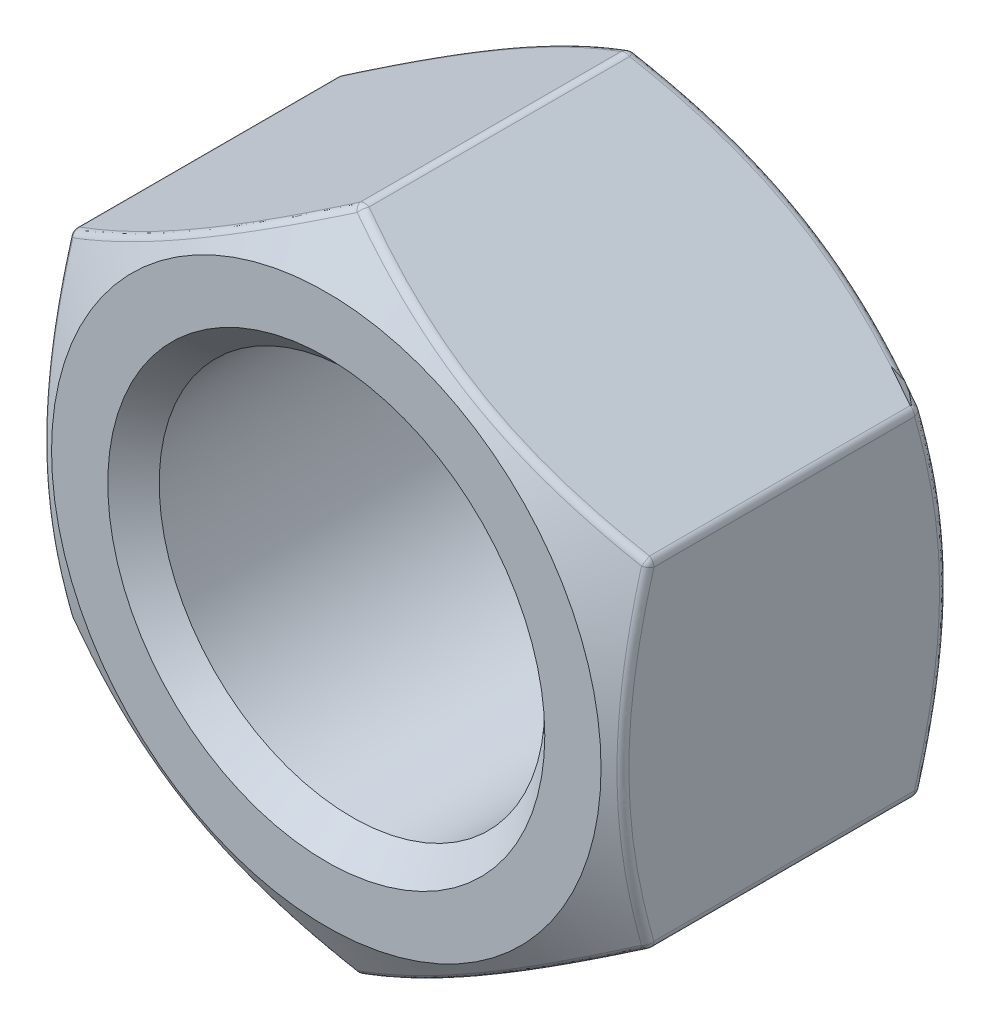
from build123d import *

# Parameters (mm, degrees)
SKETCH3_R           = 4.7625
BOSS_EXTRUDE1_DEPTH = 4.1671875
SKETCH4_OUTSIDE_W   = 71.99
SKETCH4_OUTSIDE_H   = 74.2
SKETCH4_OUTSIDE_R   = 6.7865625
CUT_EXTRUDE1_DEPTH  = 14.730957339
CUT_EXTRUDE1_DRAFT  = -60
CUT_EXTRUDE2_START  = -8.334375
SKETCH4_2_OUTSIDE_W = 100.862
SKETCH4_2_OUTSIDE_H = 103.072
SKETCH4_2_OUTSIDE_R = 6.7865625
CUT_EXTRUDE2_DEPTH  = 23.065332339
CUT_EXTRUDE2_DRAFT  = 60
FILLET1_R           = 0.2143125
CHAMFER1_SIZE       = 0.635


with BuildPart() as part:
    # Sketch3 → Boss-Extrude1 (new, symmetric)
    with BuildSketch(Plane.XY):
        Polygon((0, 8.248891971), (-7.14375, 4.124445986), (-7.14375, -4.124445986), (0, -8.248891971), (7.14375, -4.124445986), (7.14375, 4.124445986), align=None)
        Circle(SKETCH3_R, mode=Mode.SUBTRACT)
    extrude(amount=BOSS_EXTRUDE1_DEPTH, both=True)


with BuildPart() as cut_extrude1_tool:
    # Sketch4 outside → Cut-Extrude1 (with draft: the straight prism first)
    with BuildSketch(Plane.XY.offset(4.1671875)):
        Rectangle(SKETCH4_OUTSIDE_W, SKETCH4_OUTSIDE_H)
        Circle(SKETCH4_OUTSIDE_R, mode=Mode.SUBTRACT)
    extrude(amount=-CUT_EXTRUDE1_DEPTH)
    # Cut-Extrude1: the draft: its side faces are tilted about the plane it starts from
    cut_extrude1_sides = [cut_extrude1_tool.faces().sort_by_distance(p)[0] for p in [
        (0, -37.1, -3.19829117),
        (35.995, 0, -3.19829117),
        (0, 37.1, -3.19829117),
        (-35.995, 0, -3.19829117),
        (-6.7865625, 0, -3.19829117),
    ]]
    draft(cut_extrude1_sides, Plane.XY.offset(4.1671875), CUT_EXTRUDE1_DRAFT)


with BuildPart() as part_1:
    add(part.part)

    # Cut-Extrude1: cut by cut_extrude1_tool
    add(cut_extrude1_tool.part, mode=Mode.SUBTRACT)


with BuildPart() as cut_extrude2_tool:
    # Sketch4<2> outside → Cut-Extrude2 (with draft: the straight prism first)
    with BuildSketch(Plane.XY.offset(4.1671875).offset(CUT_EXTRUDE2_START)):
        Rectangle(SKETCH4_2_OUTSIDE_W, SKETCH4_2_OUTSIDE_H)
        Circle(SKETCH4_2_OUTSIDE_R, mode=Mode.SUBTRACT)
    extrude(amount=CUT_EXTRUDE2_DEPTH)
    # Cut-Extrude2: the draft: its side faces are tilted about the plane it starts from
    cut_extrude2_sides = [cut_extrude2_tool.faces().sort_by_distance(p)[0] for p in [
        (0, -51.536, 7.36547867),
        (50.431, 0, 7.36547867),
        (0, 51.536, 7.36547867),
        (-50.431, 0, 7.36547867),
        (-6.7865625, 0, 7.36547867),
    ]]
    draft(cut_extrude2_sides, Plane.XY.offset(4.1671875).offset(CUT_EXTRUDE2_START), CUT_EXTRUDE2_DRAFT)


with BuildPart() as part_2:
    add(part_1.part)

    # Cut-Extrude2: cut by cut_extrude2_tool
    add(cut_extrude2_tool.part, mode=Mode.SUBTRACT)

    # Fillet1
    fillet1_edges = [part_2.edges().sort_by_distance(p)[0] for p in [
        (7.14375, 4.124445986, 0),
        (7.14375, -4.124445986, 0),
        (7.14375, -2.084466944, 3.788972099),
        (0, -8.248891971, 0),
        (-7.14375, -4.124445986, 0),
        (-7.14375, 4.124445986, 0),
        (0, 8.248891971, 0),
        (3.571875, 6.186668978, 3.960965201),
        (-3.571875, 6.186668978, 3.960965201),
        (-7.14375, 0, 3.960965201),
        (-3.571875, -6.186668978, 3.960965201),
        (3.571875, -6.186668978, 3.960965201),
        (7.14375, -2.084466944, -3.788972099),
        (3.571875, 6.186668978, -3.960965201),
        (-3.571875, 6.186668978, -3.960965201),
        (-7.14375, 0, -3.960965201),
        (-3.571875, -6.186668978, -3.960965201),
        (3.571875, -6.186668978, -3.960965201),
    ]]
    fillet(fillet1_edges, radius=FILLET1_R)

    # Chamfer1
    chamfer1_edges = [part_2.edges().sort_by_distance(p)[0] for p in [
        (-4.7625, 0, -4.1671875),
        (-4.7625, 0, 4.1671875),
    ]]
    chamfer(chamfer1_edges, length=CHAMFER1_SIZE)


solid = part_2.part
